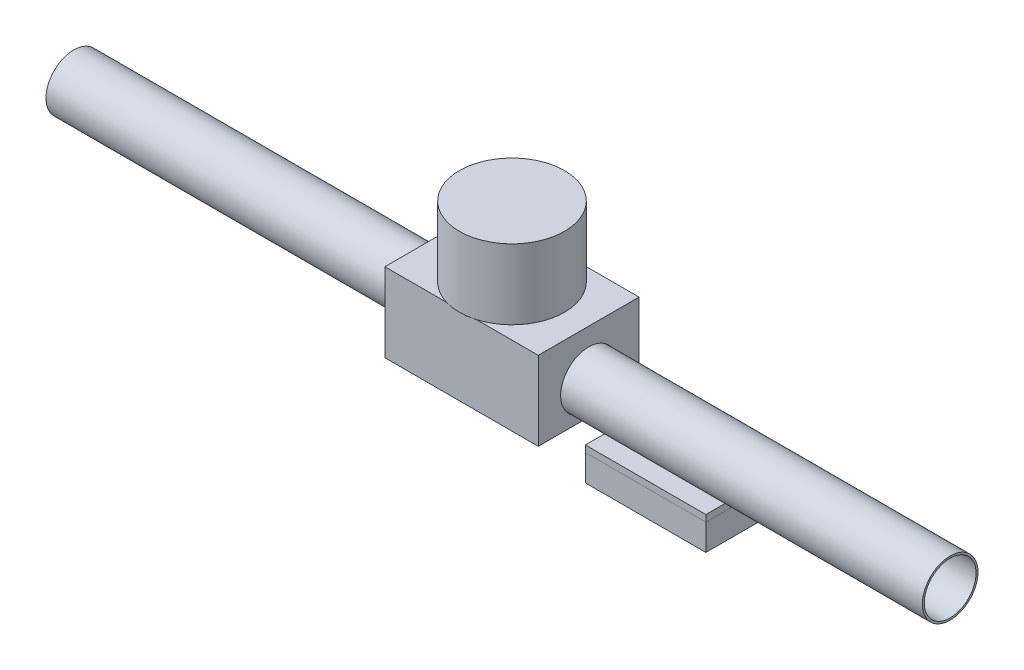
from build123d import *

# Parameters (mm, degrees)
SKETCH1_R   = 12.7
SKETCH1_R_2 = 11.811
BOOM_DEPTH  = 200
SKETCH2_W   = 46
SKETCH2_H   = 36
SKETCH2_R   = 12.8
MOUNT_DEPTH = 35
MOTOR_START = 21
SKETCH3_R   = 24
MOTOR_DEPTH = 32
PAD_START   = -12.7
SKETCH4_W   = 55
SKETCH4_H   = 28
PAD_DEPTH   = 3
ESC_START   = -15.7
SKETCH5_W   = 55
SKETCH5_H   = 28
ESC_DEPTH   = 12


with BuildPart() as part:
    # Sketch1 → Boom (new, symmetric)
    with BuildSketch(Plane(origin=(0, 0, 0), x_dir=(0, 0, -1), z_dir=(1, 0, 0))):
        Circle(SKETCH1_R)
        Circle(SKETCH1_R_2, mode=Mode.SUBTRACT)
    extrude(amount=BOOM_DEPTH, both=True)


with BuildPart() as body_2:
    # Sketch2 → Mount (new, symmetric)
    with BuildSketch(Plane(origin=(0, 0, 0), x_dir=(0, 0, -1), z_dir=(1, 0, 0))):
        with Locations((0, 3)):
            Rectangle(SKETCH2_W, SKETCH2_H)
        Circle(SKETCH2_R, mode=Mode.SUBTRACT)
    extrude(amount=MOUNT_DEPTH, both=True)


with BuildPart() as body_3:
    # Sketch3 → Motor (new body)
    with BuildSketch(Plane(origin=(0, 0, 0), x_dir=(1, 0, 0), z_dir=(0, 1, 0)).offset(MOTOR_START)):
        with Locations(Location((0, 0, 0), (0, 0, 270))):
            Circle(SKETCH3_R)
    extrude(amount=MOTOR_DEPTH)


with BuildPart() as body_4:
    # Sketch4 → Pad (new body)
    with BuildSketch(Plane(origin=(0, 0, 0), x_dir=(1, 0, 0), z_dir=(0, 1, 0)).offset(PAD_START)):
        with Locations((75, 0)):
            Rectangle(SKETCH4_W, SKETCH4_H)
    extrude(amount=-PAD_DEPTH)


with BuildPart() as body_5:
    # Sketch5 → ESC (new body)
    with BuildSketch(Plane(origin=(0, 0, 0), x_dir=(1, 0, 0), z_dir=(0, 1, 0)).offset(ESC_START)):
        with Locations((75, 0)):
            Rectangle(SKETCH5_W, SKETCH5_H)
    extrude(amount=-ESC_DEPTH)


solid = Compound([part.part, body_2.part, body_3.part, body_4.part, body_5.part])
